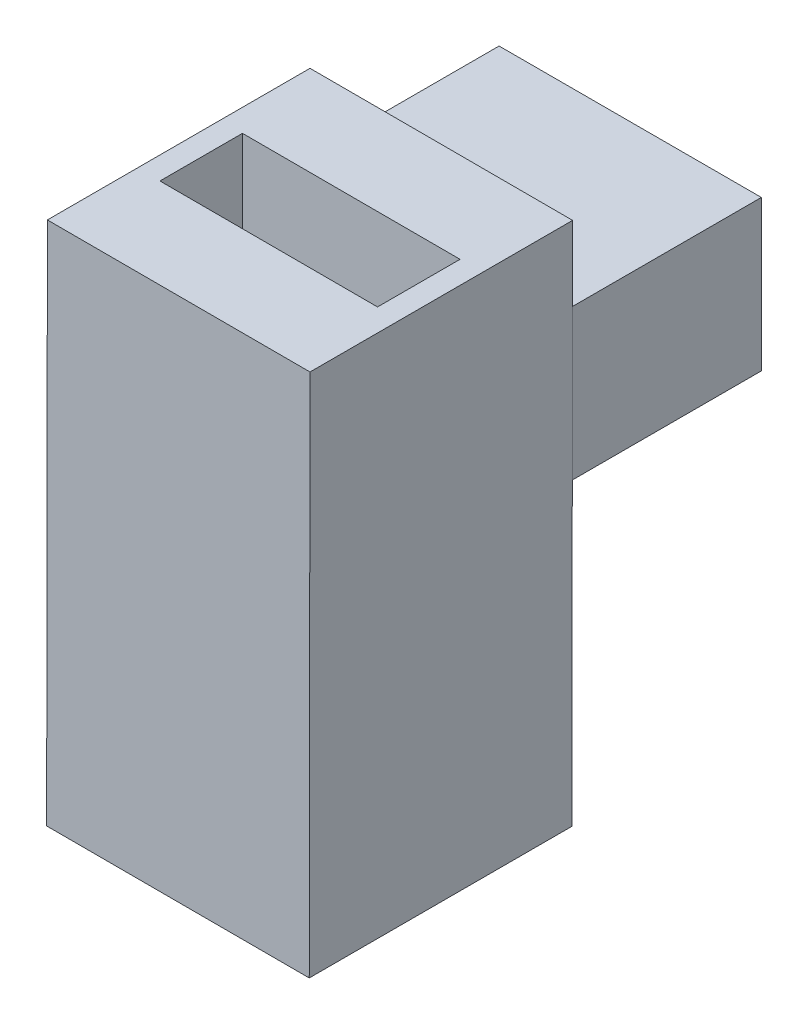
from build123d import *
from build123d.topology import SkipClean

# Parameters (mm, degrees)
SKETCH3_W           = 17.5
SKETCH3_H           = 17.5
SKETCH3_R           = 6.75
BOSS_EXTRUDE2_DEPTH = 20
BOSS_EXTRUDE1_DEPTH = 12.6
SKETCH4_W           = 17.5
SKETCH4_H           = 17.5
SKETCH4_W_2         = 14.5
SKETCH4_H_2         = 5.5
BOSS_EXTRUDE3_DEPTH = 15
CUT_EXTRUDE1_START  = -5
SKETCH2_R           = 2.575
CUT_EXTRUDE1_DEPTH  = 5
CUT_EXTRUDE2_START  = -18.6
CUT_EXTRUDE2_DEPTH  = 18.6


with BuildPart() as part:
    # Sketch3 → Boss-Extrude2 (new body)
    with BuildSketch(Plane(origin=(0, 96.858578644, 4.362132034), x_dir=(0.999998975550975, -0.0014313968704513535, 0), z_dir=(-0.0014313968704513535, -0.999998975550975, 0))):
        with Locations((0, -0.957655346)):
            Rectangle(SKETCH3_W, SKETCH3_H)
        with Locations((0, -0.957655346)):
            Circle(SKETCH3_R, mode=Mode.SUBTRACT)
    extrude(amount=BOSS_EXTRUDE2_DEPTH)



with BuildPart() as body_2:
    # Sketch1 → Boss-Extrude1 (new body)
    with BuildSketch(Plane.XY.offset(-5.345523312)):
        Polygon((-8.728127561, 96.871072071), (8.749991036, 96.846053921), (8.749991036, 106.858578644), (-8.728127561, 106.858578644), align=None)
        with BuildLine():
            Line((-2.24, 103.128627855), (2.24, 103.128627855))
            ThreePointArc((2.24, 103.128627855), (0, 99.283578644), (-2.24, 103.128627855))
        make_face(mode=Mode.SUBTRACT)
    extrude(amount=-BOSS_EXTRUDE1_DEPTH)


with BuildPart() as part_1:
    add(part.part)

    add(body_2.part)  # Boss-Extrude3 merges body 2
    # Sketch4 → Boss-Extrude3 (add)
    with BuildSketch(Plane(origin=(-0.06932148, 96.85867787, 0), x_dir=(-0.9999989755509748, 0.0014313968704517323, 0), z_dir=(-0.0014313968704517323, -0.999998975550975, 0))):
        with Locations((-0.069321551, -3.404476688)):
            Rectangle(SKETCH4_W, SKETCH4_H)
        with Locations((-0.069321551, -3.404476688)):
            Rectangle(SKETCH4_W_2, SKETCH4_H_2, mode=Mode.SUBTRACT)
    extrude(amount=-BOSS_EXTRUDE3_DEPTH)

    # Sketch2 → Cut-Extrude1 (cut)
    with BuildSketch(Plane(origin=(0, 0, -17.945523312), x_dir=(-1, 0, 0), z_dir=(0, 0, -1)).offset(CUT_EXTRUDE1_START)):
        with Locations(Location((0, 101.858578644, 0), (0, 0, 180))):
            Circle(SKETCH2_R)
    extrude(amount=CUT_EXTRUDE1_DEPTH, mode=Mode.SUBTRACT)

    # Sketch5 → Cut-Extrude2 (cut)
    with SkipClean():  # the faces are left unmerged after this step: merging them gives an invalid solid
        with BuildSketch(Plane(origin=(0, 0, -17.945523312), x_dir=(-1, 0, 0), z_dir=(0, 0, -1)).offset(CUT_EXTRUDE2_START)):
            with BuildLine():
                Line((-2.24, 103.128627855), (2.24, 103.128627855))
                ThreePointArc((2.24, 103.128627855), (0, 99.283578644), (-2.24, 103.128627855))
            make_face()
        extrude(amount=CUT_EXTRUDE2_DEPTH, mode=Mode.SUBTRACT)


solid = part_1.part
